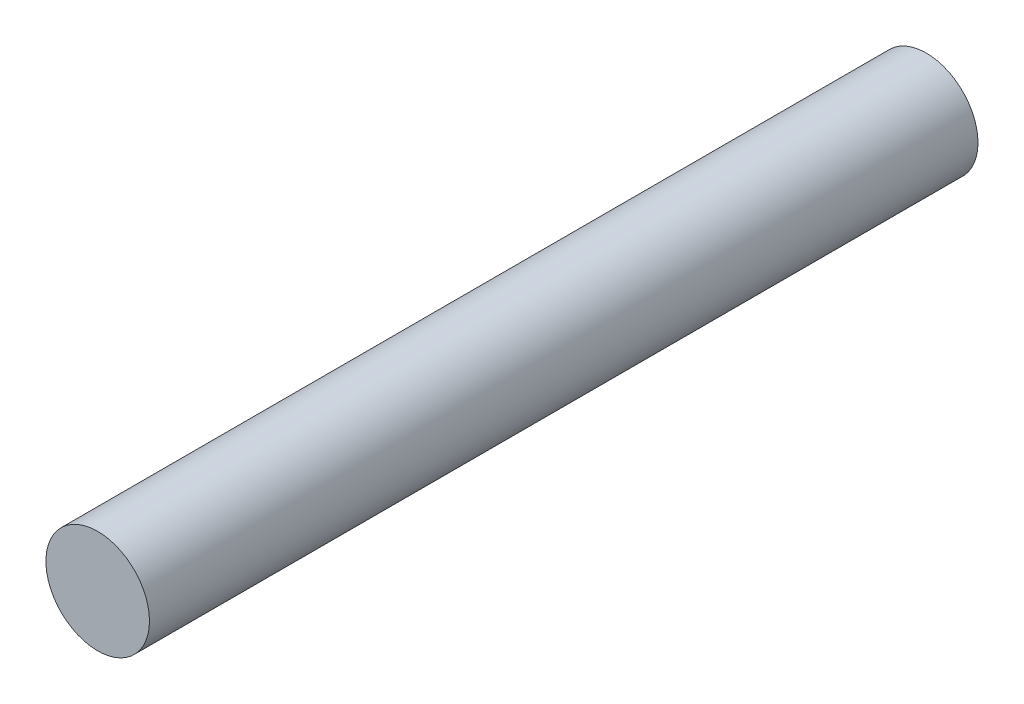
from build123d import *

# Parameters (mm, degrees)
SKETCH1_R           = 25
BOSS_EXTRUDE1_DEPTH = 400


with BuildPart() as part:
    # Sketch1 → Boss-Extrude1 (new body)
    with BuildSketch(Plane.XY):
        Circle(SKETCH1_R)
    extrude(amount=BOSS_EXTRUDE1_DEPTH)


solid = part.part
